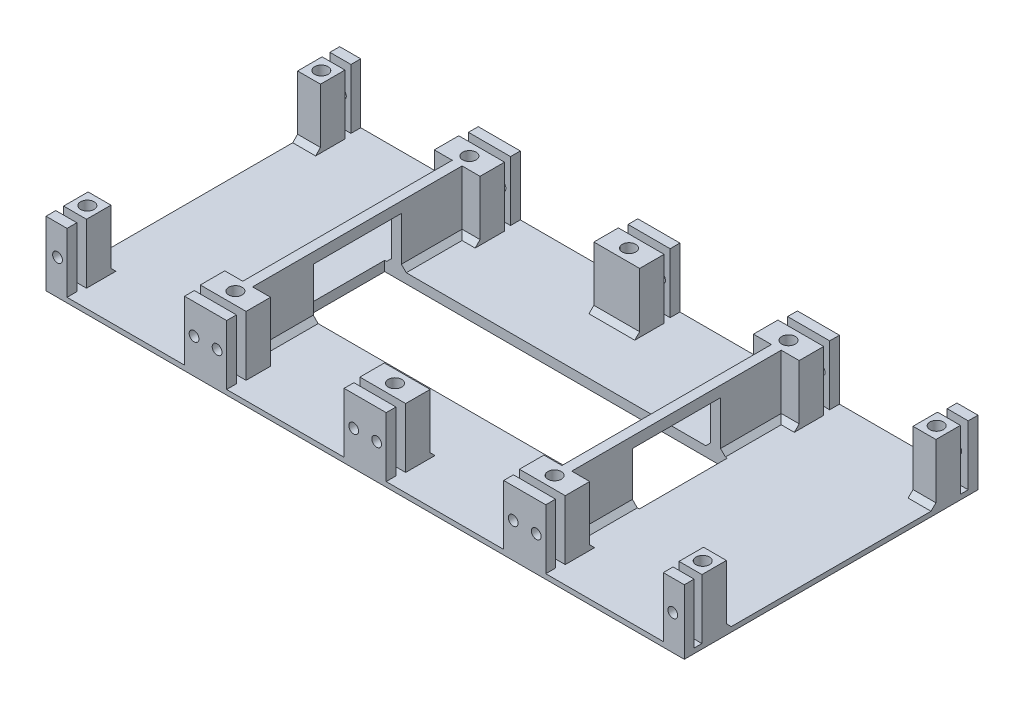
from build123d import *
from build123d.topology import SkipClean

# Parameters (mm, degrees)
CROQUIS1_W                  = 130.4
CROQUIS1_H                  = 60
SALIENTE_EXTRUIR1_DEPTH     = 2
CROQUIS3_W                  = 65.2
CROQUIS3_H                  = 12.2
CROQUIS3_R                  = 1
SALIENTE_EXTRUIR2_DEPTH     = 2
CORTAR_EXTRUIR2_REACH       = 91.737
CROQUIS5_W                  = 24
CROQUIS5_H                  = 12.2
CROQUIS6_W                  = 4.675
CROQUIS6_H                  = 5
CROQUIS6_R                  = 1.375
CROQUIS6_W_2                = 9.35
SALIENTE_EXTRUIR3_DEPTH     = 12.2
SIMETR_A2_COPY_1_SKETCH_W   = 65.2
SIMETR_A2_COPY_1_SKETCH_H   = 12.2
SIMETR_A2_COPY_1_SKETCH_R   = 1
SIMETR_A2_COPY_1_DEPTH      = 2
SIMETR_A2_COPY_2_REACH      = 91.737
SIMETR_A2_COPY_2_SKETCH_W   = 24
SIMETR_A2_COPY_2_SKETCH_H   = 12.2
SIMETR_A2_COPY_3_SKETCH_W   = 4.675
SIMETR_A2_COPY_3_SKETCH_H   = 5
SIMETR_A2_COPY_3_SKETCH_R   = 1.375
SIMETR_A2_COPY_3_SKETCH_W_2 = 9.35
SIMETR_A2_COPY_3_DEPTH      = 12.2
CHAFL_N1_SIZE               = 1
CROQUIS7_W                  = 2
CROQUIS7_H                  = 42.8
SALIENTE_EXTRUIR4_DEPTH     = 12.2
CHAFL_N2_SIZE               = 1
CROQUIS9_W                  = 70
CROQUIS9_H                  = 18
CORTAR_EXTRUIR4_DEPTH       = 12


with BuildPart() as part:
    # Croquis1 → Saliente-Extruir1 (new body)
    with BuildSketch(Plane(origin=(0, 0, 0), x_dir=(1, 0, 0), z_dir=(0, 1, 0))):
        Rectangle(CROQUIS1_W, CROQUIS1_H)
    extrude(amount=SALIENTE_EXTRUIR1_DEPTH)

    # Croquis3 → Saliente-Extruir2 (add)
    with BuildSketch(Plane.XY.offset(30)):
        with Locations((-32.6, 8.1)):
            Rectangle(CROQUIS3_W, CROQUIS3_H)
        with Locations((-62.85, 8.1)):
            Circle(CROQUIS3_R, mode=Mode.SUBTRACT)
        with Locations((-34.95, 8.1)):
            Circle(CROQUIS3_R, mode=Mode.SUBTRACT)
        with Locations(Location((-30.25, 8.1, 0), (0, 0, 180))):
            Circle(CROQUIS3_R, mode=Mode.SUBTRACT)
        with Locations(Location((-2.35, 8.1, 0), (0, 0, 180))):
            Circle(CROQUIS3_R, mode=Mode.SUBTRACT)
    saliente_extruir2 = extrude(amount=-SALIENTE_EXTRUIR2_DEPTH)

    # Croquis5 → Cortar-Extruir2 (cut, up to next)
    with BuildSketch(Plane.XY.offset(30), mode=Mode.PRIVATE) as cortar_extruir2_sk1:
        with Locations((-48.9, 8.1)):
            Rectangle(CROQUIS5_W, CROQUIS5_H)
    cortar_extruir2_tool1 = extrude(cortar_extruir2_sk1.sketch, amount=-CORTAR_EXTRUIR2_REACH, mode=Mode.PRIVATE) & part.part
    # Croquis5 → Cortar-Extruir2 (cut, up to next)
    with BuildSketch(Plane.XY.offset(30), mode=Mode.PRIVATE) as cortar_extruir2_sk2:
        with Locations((-16.3, 8.1)):
            Rectangle(CROQUIS5_W, CROQUIS5_H)
    cortar_extruir2_tool2 = extrude(cortar_extruir2_sk2.sketch, amount=-CORTAR_EXTRUIR2_REACH, mode=Mode.PRIVATE) & part.part
    cortar_extruir2_1 = cortar_extruir2_tool1.solids().sort_by_distance((-48.9, 8.1, 30))[0]
    add(cortar_extruir2_1, mode=Mode.SUBTRACT)
    cortar_extruir2_2 = cortar_extruir2_tool2.solids().sort_by_distance((-16.3, 8.1, 30))[0]
    add(cortar_extruir2_2, mode=Mode.SUBTRACT)
    cortar_extruir2 = cortar_extruir2_1 + cortar_extruir2_2  # Cortar-Extruir2 as one shape, for the pattern or mirror that repeats it

    # Croquis6 → Saliente-Extruir3 (add)
    # profile 1 of 3: a face of its own
    with BuildSketch(Plane(origin=(0, 2, 0), x_dir=(1, 0, 0), z_dir=(0, 1, 0))):
        with Locations((-62.8625, -23.9)):
            Rectangle(CROQUIS6_W, CROQUIS6_H)
        with Locations(Location((-62.856394864, -23.9, 0), (0, 0, 270))):
            Circle(CROQUIS6_R, mode=Mode.SUBTRACT)
    # profile 2 of 3: a face of its own
    with BuildSketch(Plane(origin=(0, 2, 0), x_dir=(1, 0, 0), z_dir=(0, 1, 0))):
        with Locations((-32.6, -23.9)):
            Rectangle(CROQUIS6_W_2, CROQUIS6_H)
        with Locations(Location((-32.6, -23.9, 0), (0, 0, 270))):
            Circle(CROQUIS6_R, mode=Mode.SUBTRACT)
    # profile 3 of 3: a face of its own
    with BuildSketch(Plane(origin=(0, 2, 0), x_dir=(1, 0, 0), z_dir=(0, 1, 0))):
        with BuildLine():
            Line((-4.675, -21.4), (0, -21.4))
            Line((0, -21.4), (0, -22.525))
            ThreePointArc((0, -22.525), (-1.375, -23.9), (0, -25.275))
            Line((0, -25.275), (0, -26.4))
            Line((0, -26.4), (-4.675, -26.4))
            Line((-4.675, -26.4), (-4.675, -21.4))
        make_face()
    saliente_extruir3 = extrude(amount=SALIENTE_EXTRUIR3_DEPTH)

    # Simetría1: Saliente-Extruir2, Cortar-Extruir2, Saliente-Extruir3 across plane
    add(saliente_extruir2.mirror(Plane(origin=(0, 0, 0), x_dir=(0, 0, 1), z_dir=(1, 0, 0))))
    add(cortar_extruir2.mirror(Plane(origin=(0, 0, 0), x_dir=(0, 0, 1), z_dir=(1, 0, 0))), mode=Mode.SUBTRACT)
    add(saliente_extruir3.mirror(Plane(origin=(0, 0, 0), x_dir=(0, 0, 1), z_dir=(1, 0, 0))))

    # Simetría2: Saliente-Extruir2, Cortar-Extruir2, Saliente-Extruir3 across plane
    add(saliente_extruir2.mirror(Plane.XY))
    add(cortar_extruir2.mirror(Plane.XY), mode=Mode.SUBTRACT)
    add(saliente_extruir3.mirror(Plane.XY))

    # Simetría2 copy 1 sketch → Simetría2 copy 1 (add)
    with BuildSketch(Plane(origin=(0, 0, -30), x_dir=(-1, 0, 0), z_dir=(0, 0, -1))):
        with Locations((-32.6, 8.1)):
            Rectangle(SIMETR_A2_COPY_1_SKETCH_W, SIMETR_A2_COPY_1_SKETCH_H)
        with Locations((-62.85, 8.1)):
            Circle(SIMETR_A2_COPY_1_SKETCH_R, mode=Mode.SUBTRACT)
        with Locations((-34.95, 8.1)):
            Circle(SIMETR_A2_COPY_1_SKETCH_R, mode=Mode.SUBTRACT)
        with Locations(Location((-30.25, 8.1, 0), (0, 0, 180))):
            Circle(SIMETR_A2_COPY_1_SKETCH_R, mode=Mode.SUBTRACT)
        with Locations(Location((-2.35, 8.1, 0), (0, 0, 180))):
            Circle(SIMETR_A2_COPY_1_SKETCH_R, mode=Mode.SUBTRACT)
    extrude(amount=-SIMETR_A2_COPY_1_DEPTH)

    # Simetría2 copy 2 sketch → Simetría2 copy 2 (cut, up to next)
    with BuildSketch(Plane(origin=(0, 0, -30), x_dir=(-1, 0, 0), z_dir=(0, 0, -1)), mode=Mode.PRIVATE) as simetr_a2_copy_2_sk1:
        with Locations((-48.9, 8.1)):
            Rectangle(SIMETR_A2_COPY_2_SKETCH_W, SIMETR_A2_COPY_2_SKETCH_H)
    simetr_a2_copy_2_tool1 = extrude(simetr_a2_copy_2_sk1.sketch, amount=-SIMETR_A2_COPY_2_REACH, mode=Mode.PRIVATE) & part.part
    # Simetría2 copy 2 sketch → Simetría2 copy 2 (cut, up to next)
    with BuildSketch(Plane(origin=(0, 0, -30), x_dir=(-1, 0, 0), z_dir=(0, 0, -1)), mode=Mode.PRIVATE) as simetr_a2_copy_2_sk2:
        with Locations((-16.3, 8.1)):
            Rectangle(SIMETR_A2_COPY_2_SKETCH_W, SIMETR_A2_COPY_2_SKETCH_H)
    simetr_a2_copy_2_tool2 = extrude(simetr_a2_copy_2_sk2.sketch, amount=-SIMETR_A2_COPY_2_REACH, mode=Mode.PRIVATE) & part.part
    add(simetr_a2_copy_2_tool1.solids().sort_by_distance((48.9, 8.1, -30))[0], mode=Mode.SUBTRACT)
    add(simetr_a2_copy_2_tool2.solids().sort_by_distance((16.3, 8.1, -30))[0], mode=Mode.SUBTRACT)

    # Simetría2 copy 3 sketch → Simetría2 copy 3 (add)
    # profile 1 of 3: a face of its own
    with SkipClean():  # the faces are left unmerged after this step: merging them gives an invalid solid
        with BuildSketch(Plane(origin=(0, 2, 0), x_dir=(-1, 0, 0), z_dir=(0, 1, 0))):
            with Locations((-62.8625, -23.9)):
                Rectangle(SIMETR_A2_COPY_3_SKETCH_W, SIMETR_A2_COPY_3_SKETCH_H)
            with Locations(Location((-62.856394864, -23.9, 0), (0, 0, 270))):
                Circle(SIMETR_A2_COPY_3_SKETCH_R, mode=Mode.SUBTRACT)
        # profile 2 of 3: a face of its own
        with BuildSketch(Plane(origin=(0, 2, 0), x_dir=(-1, 0, 0), z_dir=(0, 1, 0))):
            with Locations((-32.6, -23.9)):
                Rectangle(SIMETR_A2_COPY_3_SKETCH_W_2, SIMETR_A2_COPY_3_SKETCH_H)
            with Locations(Location((-32.6, -23.9, 0), (0, 0, 270))):
                Circle(SIMETR_A2_COPY_3_SKETCH_R, mode=Mode.SUBTRACT)
        # profile 3 of 3: a face of its own
        with BuildSketch(Plane(origin=(0, 2, 0), x_dir=(-1, 0, 0), z_dir=(0, 1, 0))):
            with BuildLine():
                Line((-4.675, -21.4), (0, -21.4))
                Line((0, -21.4), (0, -22.525))
                ThreePointArc((0, -22.525), (-1.375, -23.9), (0, -25.275))
                Line((0, -25.275), (0, -26.4))
                Line((0, -26.4), (-4.675, -26.4))
                Line((-4.675, -26.4), (-4.675, -21.4))
            make_face()
        extrude(amount=SIMETR_A2_COPY_3_DEPTH)

    # Chaflán1
    chafl_n1_edges = [part.edges().sort_by_distance(p)[0] for p in [
        (0, 0, 30),
        (-65.2, 0, 0),
        (0, 0, -30),
        (65.2, 0, 0),
    ]]
    chamfer(chafl_n1_edges, length=CHAFL_N1_SIZE)

    # Croquis7 → Saliente-Extruir4 (add)
    with SkipClean():  # the faces are left unmerged after this step: merging them gives an invalid solid
        with BuildSketch(Plane(origin=(0, 2, 0), x_dir=(1, 0, 0), z_dir=(0, 1, 0))):
            with Locations((-32.6, 0)):
                Rectangle(CROQUIS7_W, CROQUIS7_H)
            with Locations((32.6, 0)):
                Rectangle(CROQUIS7_W, CROQUIS7_H)
        extrude(amount=SALIENTE_EXTRUIR4_DEPTH)

    # Chaflán2
    chafl_n2_edges = [part.edges().sort_by_distance(p)[0] for p in [
        (0, 2, 21.4),
        (62.8625, 2, 21.4),
        (29.7625, 2, 21.4),
        (62.8625, 2, -21.4),
        (29.7625, 2, -21.4),
        (-2.3375, 2, -21.4),
        (-62.8625, 2, -21.4),
        (-29.7625, 2, -21.4),
        (-35.4375, 2, -21.4),
        (-35.4375, 2, 21.4),
        (-31.6, 2, 0),
        (-33.6, 2, 0),
        (35.4375, 2, -21.4),
        (35.4375, 2, 21.4),
        (33.6, 2, 0),
        (31.6, 2, 0),
        (-62.8625, 2, 21.4),
    ]]
    chamfer(chafl_n2_edges, length=CHAFL_N2_SIZE)

    # Croquis9 → Cortar-Extruir4 (cut)
    with SkipClean():  # the faces are left unmerged after this step: merging them gives an invalid solid
        with BuildSketch(Plane.XZ):
            Rectangle(CROQUIS9_W, CROQUIS9_H)
        extrude(amount=-CORTAR_EXTRUIR4_DEPTH, mode=Mode.SUBTRACT)


solid = part.part
